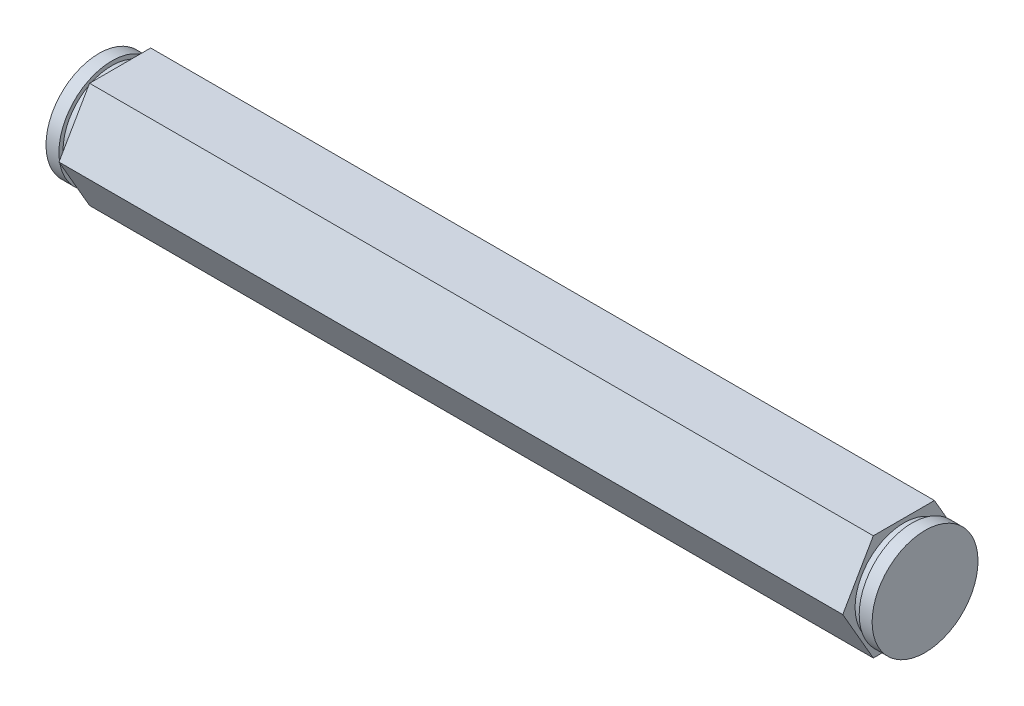
from build123d import *

# Parameters (mm, degrees)
BOSS_EXTRUDE1_DEPTH = 49.544250035


with BuildPart() as part:
    # Sketch1 → Boss-Extrude1 (new, symmetric)
    with BuildSketch(Plane(origin=(0, 0, 0), x_dir=(0, 0, -1), z_dir=(1, 0, 0))):
        Polygon((7.332348419, 0), (3.666174209, 6.35), (-3.666174209, 6.35), (-7.332348419, 0), (-3.666174209, -6.35), (3.666174209, -6.35), align=None)
    extrude(amount=BOSS_EXTRUDE1_DEPTH, both=True)

    # Sketch2 → Cut-Revolve1 (revolve, cut)
    with BuildSketch(Plane(origin=(0, 0, 0), x_dir=(1, 0, 0), z_dir=(0, 1, 0))):
        Polygon((47.004250035, -5.8547), (47.994850035, -5.8547), (47.994850035, -6.35), (49.544250035, -6.35), (49.544250035, -8.89), (47.004250035, -8.89), align=None)
    cut_revolve1 = revolve(axis=Axis((0, 0, 0), (1, 0, 0)), mode=Mode.SUBTRACT)

    # Mirror1: Cut-Revolve1 across plane
    add(cut_revolve1.mirror(Plane(origin=(0, 0, 0), x_dir=(0, 0, 1), z_dir=(1, 0, 0))), mode=Mode.SUBTRACT)


solid = part.part
